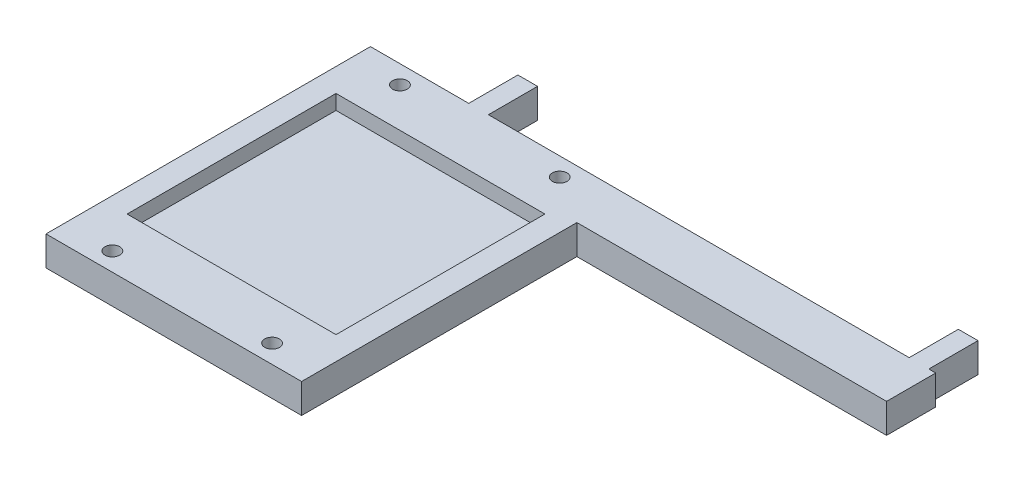
from build123d import *

# Parameters (mm, degrees)
SKETCH1_W           = 52
SKETCH1_H           = 66
BOSS_EXTRUDE1_DEPTH = 6
SKETCH2_W           = 42.5
SKETCH2_H           = 42.5
CUT_EXTRUDE1_DEPTH  = 3
SKETCH3_R           = 1.5
CUT_EXTRUDE2_DEPTH  = 13
SKETCH4_W           = 10
SKETCH4_H           = 6
BOSS_EXTRUDE2_DEPTH = 63
SKETCH5_W           = 4
SKETCH5_H           = 6
BOSS_EXTRUDE3_DEPTH = 10


with BuildPart() as part:
    # Sketch1 → Boss-Extrude1 (new body)
    with BuildSketch(Plane(origin=(0, 0, 0), x_dir=(1, 0, 0), z_dir=(0, 1, 0))):
        with Locations((-26, -33)):
            Rectangle(SKETCH1_W, SKETCH1_H)
    extrude(amount=BOSS_EXTRUDE1_DEPTH)

    # Sketch2 → Cut-Extrude1 (cut)
    with BuildSketch(Plane(origin=(0, 6, 0), x_dir=(1, 0, 0), z_dir=(0, 1, 0))):
        with Locations((-26, -33)):
            Rectangle(SKETCH2_W, SKETCH2_H)
    extrude(amount=-CUT_EXTRUDE1_DEPTH, mode=Mode.SUBTRACT)

    # Sketch3 → Cut-Extrude2 (cut)
    with BuildSketch(Plane(origin=(0, 6, 0), x_dir=(1, 0, 0), z_dir=(0, 1, 0))):
        with Locations(Location((-42.25, -3.75, 0), (0, 0, 270))):
            Circle(SKETCH3_R)
        with Locations(Location((-9.75, -3.75, 0), (0, 0, 90))):
            Circle(SKETCH3_R)
        with Locations(Location((-9.75, -62.25, 0), (0, 0, 270))):
            Circle(SKETCH3_R)
        with Locations(Location((-42.25, -62.25, 0), (0, 0, 90))):
            Circle(SKETCH3_R)
    extrude(amount=-CUT_EXTRUDE2_DEPTH, mode=Mode.SUBTRACT)

    # Sketch4 → Boss-Extrude2 (add)
    with BuildSketch(Plane(origin=(0, 0, 0), x_dir=(0, 0, -1), z_dir=(1, 0, 0))):
        with Locations((-5, 3)):
            Rectangle(SKETCH4_W, SKETCH4_H)
    extrude(amount=BOSS_EXTRUDE2_DEPTH)

    # Sketch5 → Boss-Extrude3 (add)
    with BuildSketch(Plane(origin=(0, 0, 0), x_dir=(-1, 0, 0), z_dir=(0, 0, -1))):
        with Locations((30, 3)):
            Rectangle(SKETCH5_W, SKETCH5_H)
        with Locations((-59.6, 3)):
            Rectangle(SKETCH5_W, SKETCH5_H)
    extrude(amount=BOSS_EXTRUDE3_DEPTH)


solid = part.part
